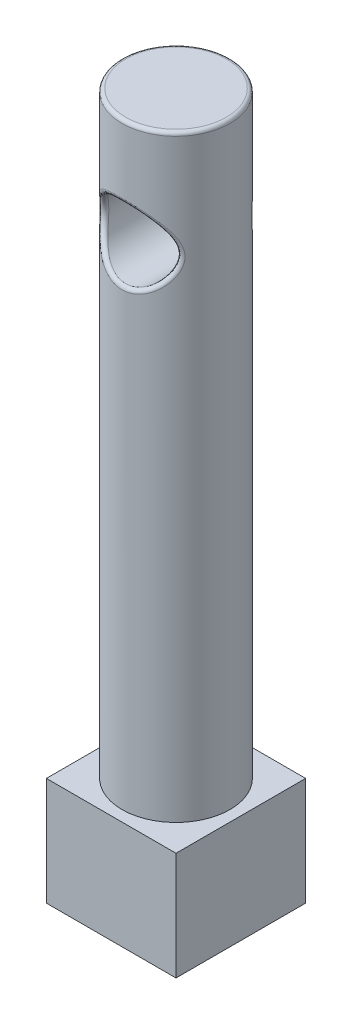
from build123d import *

# Parameters (mm, degrees)
ESQUISSE1_R                  = 1.5
BOSS_EXTRU_1_DEPTH           = 16.6
ENL_V_MAT_EXTRU_1_DEPTH      = 17.734993278
ENL_V_MAT_EXTRU_1_DEPTH_BACK = 17.734993278
ESQUISSE2_R                  = 1
CONG_1_R                     = 0.1
ESQUISSE3_W                  = 3.6
ESQUISSE3_H                  = 3.6
BOSS_EXTRU_2_DEPTH           = 3


with BuildPart() as part:
    # Esquisse1 → Boss.-Extru.1 (new body)
    with BuildSketch(Plane(origin=(0, 0, 0), x_dir=(1, 0, 0), z_dir=(0, 1, 0))):
        with Locations(Location((0, 0, 0), (0, 0, 90))):
            Circle(ESQUISSE1_R)
    extrude(amount=BOSS_EXTRU_1_DEPTH)

    # Esquisse2 → Enlèv. mat.-Extru.1 (cut, two sides: drawn at the far end of the back side and taken through both)
    with BuildSketch(Plane.XY.offset(-ENL_V_MAT_EXTRU_1_DEPTH_BACK)):
        with Locations(Location((0, 13.6, 0), (0, 0, 90.000000013))):
            Circle(ESQUISSE2_R)
    extrude(amount=ENL_V_MAT_EXTRU_1_DEPTH + ENL_V_MAT_EXTRU_1_DEPTH_BACK, mode=Mode.SUBTRACT)

    # Congé1
    cong_1_edges = [part.edges().sort_by_distance(p)[0] for p in [
        (0, 16.6, 1.5),
        (0, 12.6, 1.5),
        (1, 13.6, -1.118033989),
    ]]
    fillet(cong_1_edges, radius=CONG_1_R)

    # Esquisse3 → Boss.-Extru.2 (add)
    with BuildSketch(Plane(origin=(0, 0, 0), x_dir=(1, 0, 0), z_dir=(0, 1, 0))):
        Rectangle(ESQUISSE3_W, ESQUISSE3_H)
    extrude(amount=-BOSS_EXTRU_2_DEPTH)


solid = part.part
